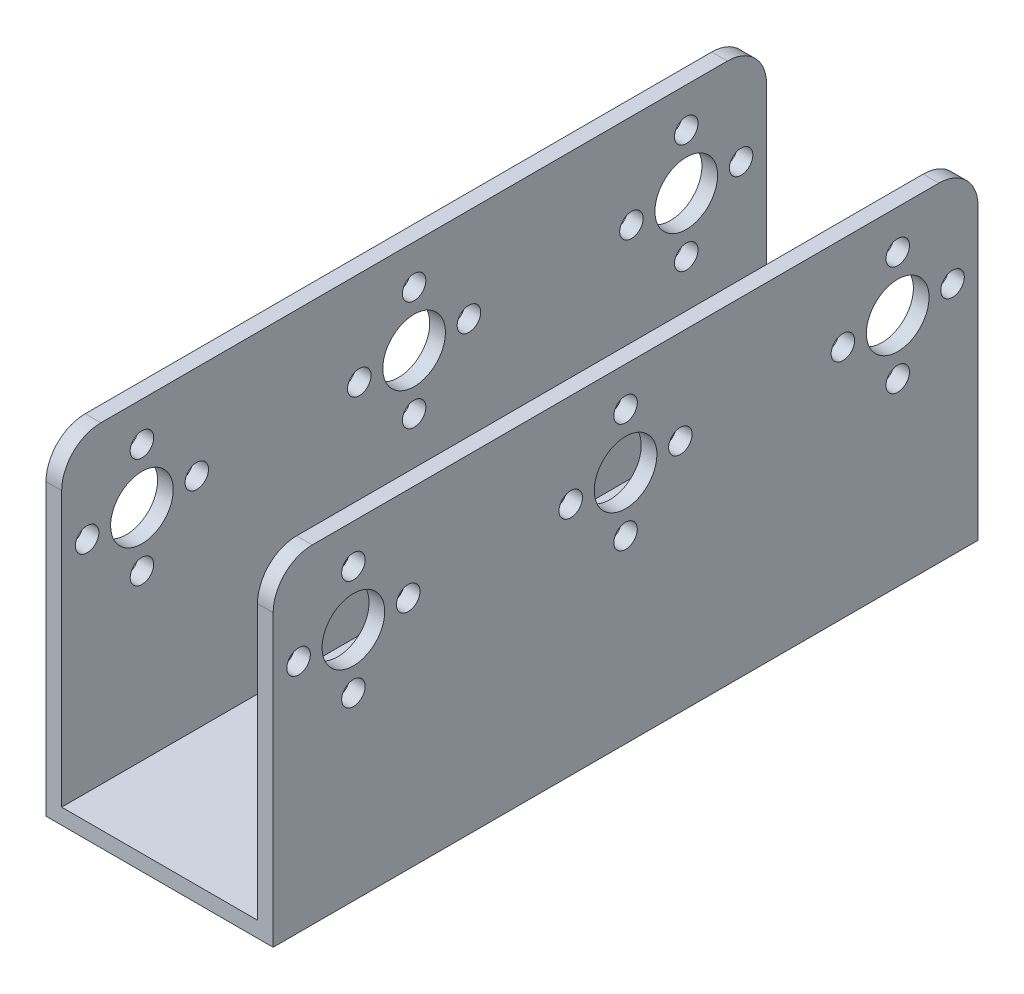
from build123d import *

# Parameters (mm, degrees)
EXTRUDE_1_DEPTH     = 90
SKETCH_2_R          = 4
SKETCH_2_R_2        = 1.5
CUT_EXTRUDE_1_DEPTH = 90
FILLET_1_R          = 5


with BuildPart() as part:
    # 草图1 → 凸台-拉伸1 (new body)
    with BuildSketch(Plane.XY):
        Polygon((-14.5, 40), (-14.5, -2), (14.5, -2), (14.5, 40), (12.5, 40), (12.5, 0), (-12.5, 0), (-12.5, 40), align=None)
    extrude(amount=-EXTRUDE_1_DEPTH)

    # 草图2 → 切除-拉伸1 (cut)
    with BuildSketch(Plane(origin=(14.5, 0, 0), x_dir=(0, 0, -1), z_dir=(1, 0, 0))):
        with Locations(Location((79.75, 28, 0), (0, 0, 90))):
            Circle(SKETCH_2_R)
        with Locations(Location((79.75, 35, 0), (0, 0, 90))):
            Circle(SKETCH_2_R_2)
        with Locations(Location((86.75, 28, 0), (0, 0, 90))):
            Circle(SKETCH_2_R_2)
        with Locations(Location((79.75, 21, 0), (0, 0, 90))):
            Circle(SKETCH_2_R_2)
        with Locations(Location((72.75, 28, 0), (0, 0, 90))):
            Circle(SKETCH_2_R_2)
        with Locations(Location((10.25, 21, 0), (0, 0, 90))):
            Circle(SKETCH_2_R_2)
        with Locations(Location((3.25, 28, 0), (0, 0, 90))):
            Circle(SKETCH_2_R_2)
        with Locations(Location((10.25, 35, 0), (0, 0, 90))):
            Circle(SKETCH_2_R_2)
        with Locations(Location((10.25, 28, 0), (0, 0, 90))):
            Circle(SKETCH_2_R)
        with Locations(Location((17.25, 28, 0), (0, 0, 90))):
            Circle(SKETCH_2_R_2)
        with Locations(Location((45, 28, 0), (0, 0, 90))):
            Circle(SKETCH_2_R)
        with Locations(Location((45, 35, 0), (0, 0, 90))):
            Circle(SKETCH_2_R_2)
        with Locations(Location((52, 28, 0), (0, 0, 90))):
            Circle(SKETCH_2_R_2)
        with Locations(Location((45, 21, 0), (0, 0, 90))):
            Circle(SKETCH_2_R_2)
        with Locations(Location((38, 28, 0), (0, 0, 90))):
            Circle(SKETCH_2_R_2)
    extrude(amount=-CUT_EXTRUDE_1_DEPTH, mode=Mode.SUBTRACT)

    # 圆角1
    fillet_1_edges = [part.edges().sort_by_distance(p)[0] for p in [
        (-13.5, 40, 0),
        (13.5, 40, -90),
        (-13.5, 40, -90),
        (13.5, 40, 0),
    ]]
    fillet(fillet_1_edges, radius=FILLET_1_R)


solid = part.part
